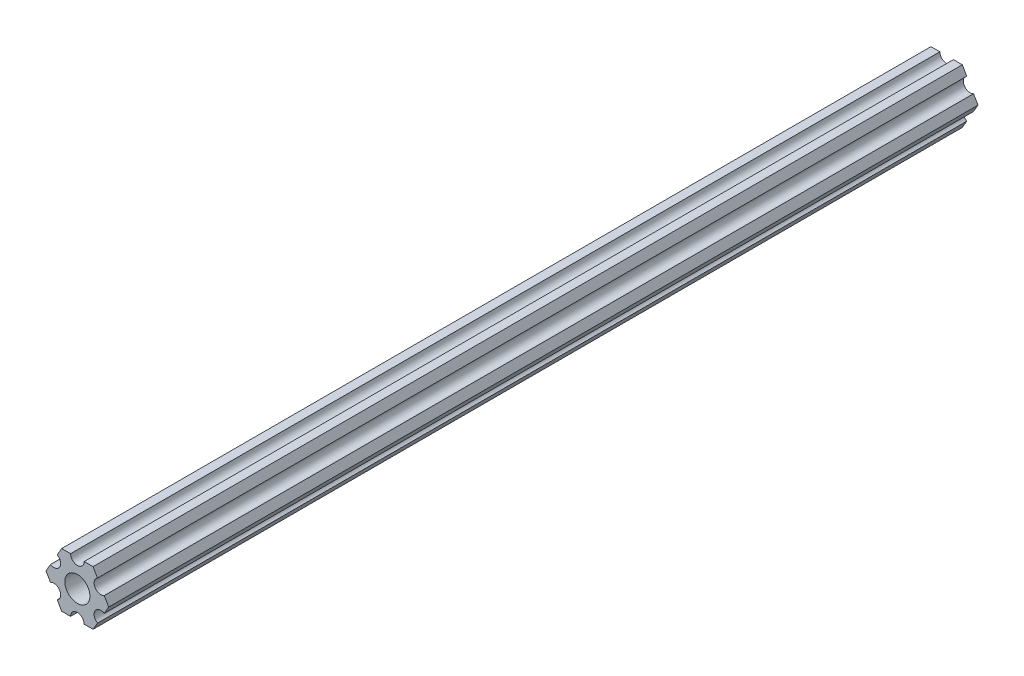
from build123d import *

# Parameters (mm, degrees)
SKETCH1_R           = 2.9337
BOSS_EXTRUDE1_DEPTH = 203.2


with BuildPart() as part:
    # Sketch1 → Boss-Extrude1 (new body)
    with BuildSketch(Plane.XY):
        with BuildLine():
            Line((-4.70551159, -4.549815043), (-3.666174521, -6.349999904))
            Line((-3.666174521, -6.349999904), (-1.587501154, -6.349999904))
            ThreePointArc((-1.587501154, -6.349999904), (-3.85e-07, -4.762499134), (1.587501154, -6.349999904))
            Line((1.587501154, -6.349999904), (3.666173825, -6.349999904))
            Line((3.666173825, -6.349999904), (4.705510929, -4.549815232))
            ThreePointArc((4.705510929, -4.549815232), (4.124445601, -2.381249904), (6.293010929, -1.800184575))
            Line((6.293010929, -1.800184575), (7.332348034, 9.6e-08))
            Line((7.332348034, 9.6e-08), (6.293011178, 1.800184715))
            ThreePointArc((6.293011178, 1.800184715), (4.124445902, 2.381250241), (4.705511428, 4.549815516))
            Line((4.705511428, 4.549815516), (3.666174521, 6.350000222))
            Line((3.666174521, 6.350000222), (1.587498846, 6.350000222))
            ThreePointArc((1.587498846, 6.350000222), (3.85e-07, 4.762501761), (-1.587498846, 6.350000222))
            Line((-1.587498846, 6.350000222), (-3.666173825, 6.350000222))
            Line((-3.666173825, 6.350000222), (-4.705511038, 4.549815614))
            ThreePointArc((-4.705511038, 4.549815614), (-4.124445841, 2.38125025), (-6.293011205, 1.800185053))
            Line((-6.293011205, 1.800185053), (-7.332348419, 4.44e-07))
            Line((-7.332348419, 4.44e-07), (-6.293011423, -1.80018429))
            ThreePointArc((-6.293011423, -1.80018429), (-4.12444613, -2.38124975), (-4.70551159, -4.549815043))
        make_face()
        with Locations(Location((0, 0, 0), (0, 0, 180))):
            Circle(SKETCH1_R, mode=Mode.SUBTRACT)
    extrude(amount=-BOSS_EXTRUDE1_DEPTH)


solid = part.part
